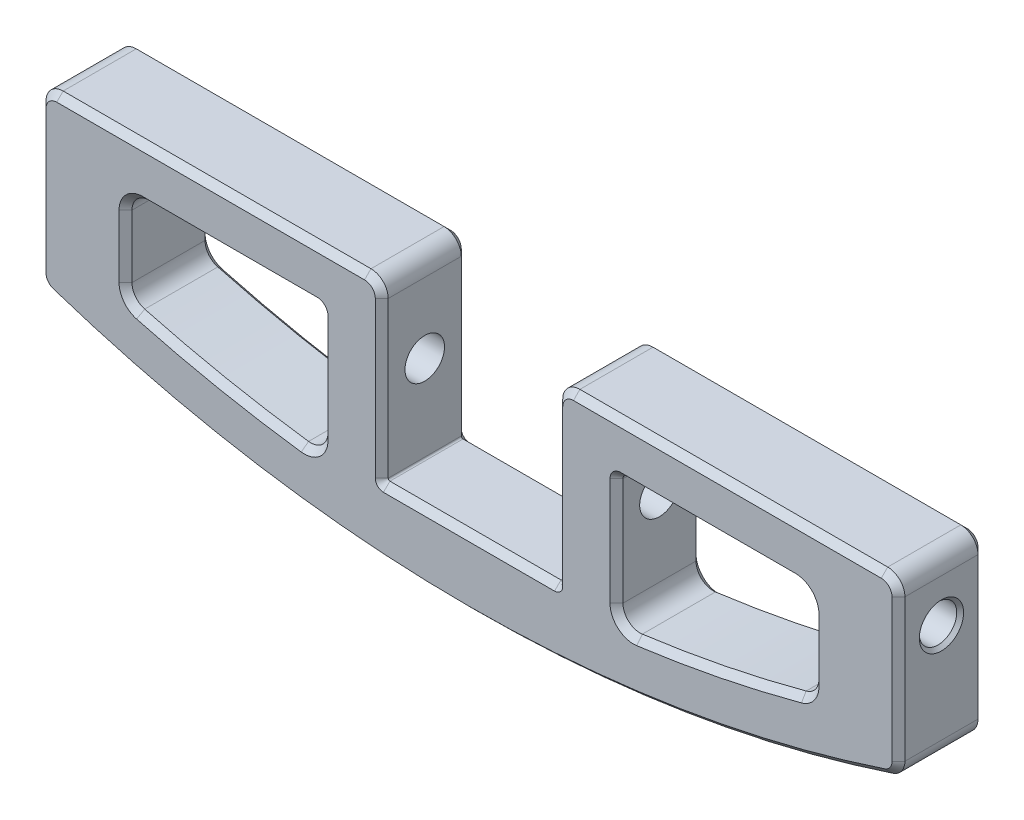
from build123d import *

# Parameters (mm, degrees)
AUFSATZ_LINEAR_AUSTRAGEN1_DEPTH      = 10
SKIZZE2_R                            = 2.175
SCHNITT_LINEAR_AUSTRAGEN1_DEPTH      = 8
SCHNITT_LINEAR_AUSTRAGEN2_DEPTH      = 30
SCHNITT_LINEAR_AUSTRAGEN2_DEPTH_BACK = 10
SKIZZE3_R                            = 2.3
VERRUNDUNG1_R                        = 2
VERRUNDUNG2_R                        = 0.2
VERRUNDUNG3_R                        = 0.5
FASE1_SIZE                           = 0.75
FASE2_SIZE                           = 0.4


with BuildPart() as part:
    # Skizze1 → Aufsatz-Linear austragen1 (new body)
    with BuildSketch(Plane.XY):
        with BuildLine():
            Line((10.15, 0), (10.15, -20.3))
            Line((10.15, -20.3), (-10.15, -20.3))
            Line((-10.15, -20.3), (-10.15, 0))
            Line((-10.15, 0), (-49.95, 0))
            Line((-49.95, 0), (-49.95, -20))
            ThreePointArc((-49.95, -20), (-25.317447047, -26.210871087), (0, -28.3))
            ThreePointArc((0, -28.3), (25.317447047, -26.210871087), (49.95, -20))
            Line((49.95, -20), (49.95, 0))
            Line((49.95, 0), (10.15, 0))
        make_face()
        with BuildLine():
            Line((17.15, -6), (17.15, -21.30603648))
            ThreePointArc((17.15, -21.30603648), (28.637839253, -19.511539955), (39.95, -16.823476023))
            Line((39.95, -16.823476023), (39.95, -6))
            Line((39.95, -6), (17.15, -6))
        make_face(mode=Mode.SUBTRACT)
        with BuildLine():
            Line((-17.15, -6), (-39.95, -6))
            Line((-39.95, -6), (-39.95, -16.823476023))
            ThreePointArc((-39.95, -16.823476023), (-28.637839253, -19.511539955), (-17.15, -21.30603648))
            Line((-17.15, -21.30603648), (-17.15, -6))
        make_face(mode=Mode.SUBTRACT)
    extrude(amount=AUFSATZ_LINEAR_AUSTRAGEN1_DEPTH)

    # Skizze2 → Schnitt-Linear austragen1 (cut)
    with BuildSketch(Plane(origin=(49.95, 0, 0), x_dir=(0, 0, -1), z_dir=(1, 0, 0))):
        with Locations((-5, -7)):
            Circle(SKIZZE2_R)
    schnitt_linear_austragen1 = extrude(amount=-SCHNITT_LINEAR_AUSTRAGEN1_DEPTH, mode=Mode.SUBTRACT)

    # Spiegeln1: Schnitt-Linear austragen1 across plane
    add(schnitt_linear_austragen1.mirror(Plane(origin=(0, 0, 0), x_dir=(0, 0, 1), z_dir=(1, 0, 0))), mode=Mode.SUBTRACT)

    # Skizze3 → Schnitt-Linear austragen2 (cut, two sides: drawn at the far end of the back side and taken through both)
    with BuildSketch(Plane.ZY.offset(-10.15).offset(-SCHNITT_LINEAR_AUSTRAGEN2_DEPTH_BACK)):
        with Locations(Location((5, -10.15, 0), (0, 0, 270))):
            Circle(SKIZZE3_R)
    extrude(amount=SCHNITT_LINEAR_AUSTRAGEN2_DEPTH + SCHNITT_LINEAR_AUSTRAGEN2_DEPTH_BACK, mode=Mode.SUBTRACT)

    # Verrundung1
    verrundung1_edges = [part.edges().sort_by_distance(p)[0] for p in [
        (49.95, 0, 5),
        (49.95, -20, 5),
        (-49.95, -20, 5),
        (-49.95, 0, 5),
        (-10.15, 0, 5),
        (10.15, 0, 5),
        (39.95, -16.823476023, 5),
        (39.95, -6, 5),
        (17.15, -21.30603648, 5),
        (-17.15, -21.30603648, 5),
        (-39.95, -6, 5),
        (-39.95, -16.823476023, 5),
    ]]
    fillet(verrundung1_edges, radius=VERRUNDUNG1_R)

    # Verrundung2
    verrundung2_edges = [part.edges().sort_by_distance(p)[0] for p in [
        (-10.15, -20.3, 5),
        (10.15, -20.3, 5),
    ]]
    fillet(verrundung2_edges, radius=VERRUNDUNG2_R)

    # Verrundung3
    verrundung3_edges = [part.edges().sort_by_distance(p)[0] for p in [
        (17.15, -6, 5),
        (-17.15, -6, 5),
    ]]
    fillet(verrundung3_edges, radius=VERRUNDUNG3_R)

    # Fase1
    fase1_edges = [part.edges().sort_by_distance(p)[0] for p in [
        (-17.831485792, -20.546408723, 0),
        (-17.831485792, -20.546408723, 10),
        (-39.536902903, -16.514831798, 0),
        (-39.536902903, -16.514831798, 10),
        (-39.364213562, -6.585786438, 0),
        (-39.364213562, -6.585786438, 10),
        (39.364213562, -6.585786438, 0),
        (39.364213562, -6.585786438, 10),
        (39.536902903, -16.514831798, 0),
        (39.536902903, -16.514831798, 10),
        (17.831485792, -20.546408723, 0),
        (17.831485792, -20.546408723, 10),
        (-10.15, -11.05, 0),
        (-10.15, -11.05, 10),
        (0, -20.3, 0),
        (0, -20.3, 10),
        (-10.091421356, -20.241421356, 0),
        (-10.091421356, -20.241421356, 10),
        (10.091421356, -20.241421356, 0),
        (10.091421356, -20.241421356, 10),
        (-27.8, -6, 10),
        (-27.8, -6, 0),
        (17.15, -12.771286766, 10),
        (17.15, -12.771286766, 0),
        (-17.296446609, -6.146446609, 0),
        (-17.296446609, -6.146446609, 10),
        (17.296446609, -6.146446609, 0),
        (17.296446609, -6.146446609, 10),
        (30.05, 0, 0),
        (30.05, 0, 10),
        (49.95, -10.281445763, 0),
        (0, -28.3, 0),
        (-49.95, -10.281445763, 0),
        (-30.05, 0, 0),
        (10.15, -11.05, 0),
        (29.00206817, -19.439458054, 0),
        (39.95, -11.648782352, 0),
        (27.8, -6, 0),
        (-29.00206817, -19.439458054, 0),
        (-17.15, -12.771286766, 0),
        (-39.95, -11.648782352, 0),
        (49.571435511, -19.733765937, 0),
        (-49.571435511, -19.733765937, 0),
        (-49.364213562, -0.585786438, 0),
        (-10.735786438, -0.585786438, 0),
        (10.735786438, -0.585786438, 0),
        (49.364213562, -0.585786438, 0),
        (49.95, -10.281445763, 10),
        (39.95, -11.648782352, 10),
        (29.00206817, -19.439458054, 10),
        (27.8, -6, 10),
        (10.15, -11.05, 10),
        (-30.05, 0, 10),
        (-49.95, -10.281445763, 10),
        (0, -28.3, 10),
        (-17.15, -12.771286766, 10),
        (-29.00206817, -19.439458054, 10),
        (-39.95, -11.648782352, 10),
        (49.571435511, -19.733765937, 10),
        (-49.571435511, -19.733765937, 10),
        (-49.364213562, -0.585786438, 10),
        (-10.735786438, -0.585786438, 10),
        (10.735786438, -0.585786438, 10),
        (49.364213562, -0.585786438, 10),
    ]]
    chamfer(fase1_edges, length=FASE1_SIZE)

    # Fase2
    fase2_edges = [part.edges().sort_by_distance(p)[0] for p in [
        (49.95, -7, 7.175),
        (-49.95, -7, 7.175),
    ]]
    chamfer(fase2_edges, length=FASE2_SIZE)


solid = part.part
